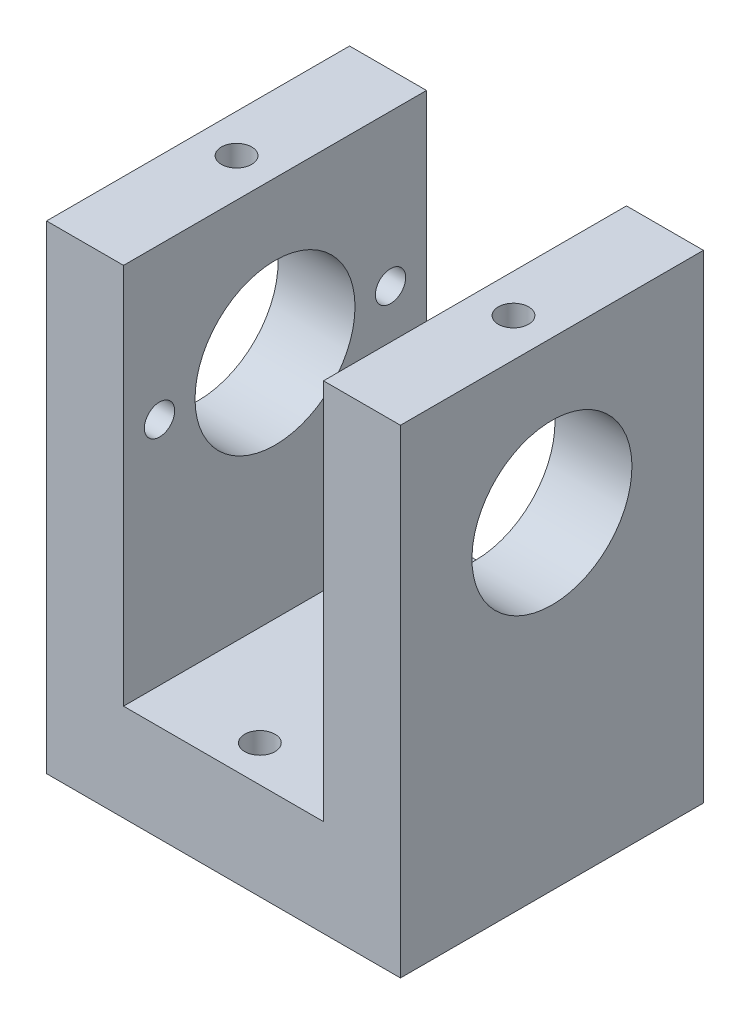
from build123d import *

# Parameters (mm, degrees)
BOSS_EXTRUDE1_DEPTH             = 12.5
BOSS_EXTRUDE1_DEPTH_BACK        = 12.5
SKETCH3_R                       = 6.6
CUT_EXTRUDE1_DEPTH              = 42.688007868
TAP_DRILL_FOR_M3X0_5_TAP3_D     = 2.5
TAP_DRILL_FOR_M3X0_5_TAP3_DEPTH = 7
TAP_DRILL_FOR_M3X0_5_TAP3_TIP   = 0.751075774
TAP_DRILL_FOR_M4X0_7_TAP1_D     = 3.3
TAP_DRILL_FOR_M4X0_7_TAP1_DEPTH = 8
TAP_DRILL_FOR_M4X0_7_TAP1_TIP   = 0.991420021
TAP_DRILL_FOR_M3X0_5_TAP4_D     = 2.5
TAP_DRILL_FOR_M3X0_5_TAP4_DEPTH = 6.35
TAP_DRILL_FOR_M3X0_5_TAP5_D     = 2.5


with BuildPart() as part:
    # Sketch1 → Boss-Extrude1 (new, two sides: drawn at the far end of the back side and taken through both)
    with BuildSketch(Plane.XY.offset(-BOSS_EXTRUDE1_DEPTH_BACK)):
        Polygon((-14.6, 12.5), (-14.6, -27), (14.6, -27), (14.6, 12.5), (8.25, 12.5), (8.25, -19), (-8.25, -19), (-8.25, 12.5), align=None)
    extrude(amount=BOSS_EXTRUDE1_DEPTH + BOSS_EXTRUDE1_DEPTH_BACK)

    # Sketch3 → Cut-Extrude1 (cut, through all)
    with BuildSketch(Plane.ZY.offset(14.6)):
        with Locations(Location((0, 0, 0), (0, 0, 270))):
            Circle(SKETCH3_R)
    extrude(amount=-CUT_EXTRUDE1_DEPTH, mode=Mode.SUBTRACT)

    # Tap Drill for M3x0.5 Tap3
    with Locations(Plane(origin=(0, 12.5, 0), x_dir=(1, 0, 0), z_dir=(0, 1, 0))):
        with Locations((-11.425, 0), (11.425, 0)):
            Hole(TAP_DRILL_FOR_M3X0_5_TAP3_D / 2, depth=TAP_DRILL_FOR_M3X0_5_TAP3_DEPTH)
            with Locations((0, 0, -(TAP_DRILL_FOR_M3X0_5_TAP3_DEPTH + TAP_DRILL_FOR_M3X0_5_TAP3_TIP / 2))):  # 118° drill point
                Cone(0, TAP_DRILL_FOR_M3X0_5_TAP3_D / 2, TAP_DRILL_FOR_M3X0_5_TAP3_TIP, mode=Mode.SUBTRACT)

    # Tap Drill for M4x0.7 Tap1
    with Locations(Plane(origin=(0, -27, 0), x_dir=(-1, 0, 0), z_dir=(0, -1, 0))):
        with Locations((-10.1, 0), (10.1, 0)):
            Hole(TAP_DRILL_FOR_M4X0_7_TAP1_D / 2, depth=TAP_DRILL_FOR_M4X0_7_TAP1_DEPTH)
            with Locations((0, 0, -(TAP_DRILL_FOR_M4X0_7_TAP1_DEPTH + TAP_DRILL_FOR_M4X0_7_TAP1_TIP / 2))):  # 118° drill point
                Cone(0, TAP_DRILL_FOR_M4X0_7_TAP1_D / 2, TAP_DRILL_FOR_M4X0_7_TAP1_TIP, mode=Mode.SUBTRACT)

    # Tap Drill for M3x0.5 Tap4
    with Locations(Plane.ZY.offset(14.6)):
        with Locations((-9.53, 0), (9.53, 0)):
            Hole(TAP_DRILL_FOR_M3X0_5_TAP4_D / 2, depth=TAP_DRILL_FOR_M3X0_5_TAP4_DEPTH)

    # Tap Drill for M3x0.5 Tap5 (through all)
    with Locations(Plane(origin=(0, -27, 0), x_dir=(-1, 0, 0), z_dir=(0, -1, 0))):
        with Locations((0, -9.5), (0, 9.5)):
            Hole(TAP_DRILL_FOR_M3X0_5_TAP5_D / 2)


solid = part.part
